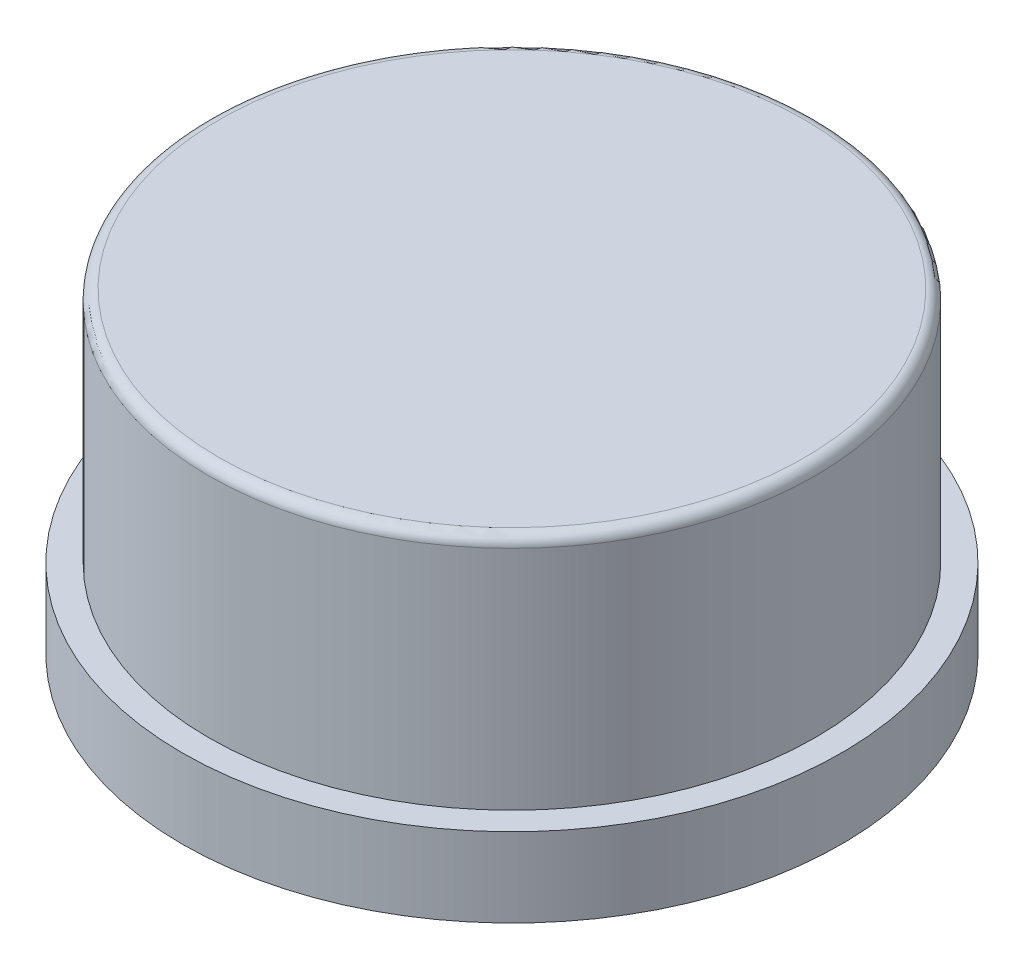
from build123d import *

# Parameters (mm, degrees)
SKETCH7_R           = 6.25
BOSS_EXTRUDE2_DEPTH = 1.5
SKETCH8_R           = 5.75
BOSS_EXTRUDE3_DEPTH = 4.5
FILLET4_R           = 0.2
SKETCH9_W           = 5
SKETCH9_H           = 5
BOSS_EXTRUDE4_DEPTH = 0.1
SHELL3_T            = -0.6


with BuildPart() as part:
    # Sketch7 → Boss-Extrude2 (new body)
    with BuildSketch(Plane(origin=(0, 0, 0), x_dir=(1, 0, 0), z_dir=(0, 1, 0))):
        with Locations(Location((0, 0, 0), (0, 0, 270))):
            Circle(SKETCH7_R)
    extrude(amount=BOSS_EXTRUDE2_DEPTH)

    # Sketch8 → Boss-Extrude3 (add)
    with BuildSketch(Plane(origin=(0, 1.5, 0), x_dir=(1, 0, 0), z_dir=(0, 1, 0))):
        with Locations(Location((0, 0, 0), (0, 0, 270))):
            Circle(SKETCH8_R)
    extrude(amount=BOSS_EXTRUDE3_DEPTH)

    # Fillet4
    fillet4_edges = [part.edges().sort_by_distance(p)[0] for p in [
        (0, 6, -5.75),
    ]]
    fillet(fillet4_edges, radius=FILLET4_R)

    # Sketch9 → Boss-Extrude4 (add)
    with BuildSketch(Plane.XZ):
        Rectangle(SKETCH9_W, SKETCH9_H)
    extrude(amount=BOSS_EXTRUDE4_DEPTH)

    # Shell3
    shell3_openings = [part.faces().sort_by_distance(p)[0] for p in [
        (0, -0.1, 0),
    ]]
    offset(amount=SHELL3_T, openings=shell3_openings, kind=Kind.INTERSECTION)


solid = part.part
